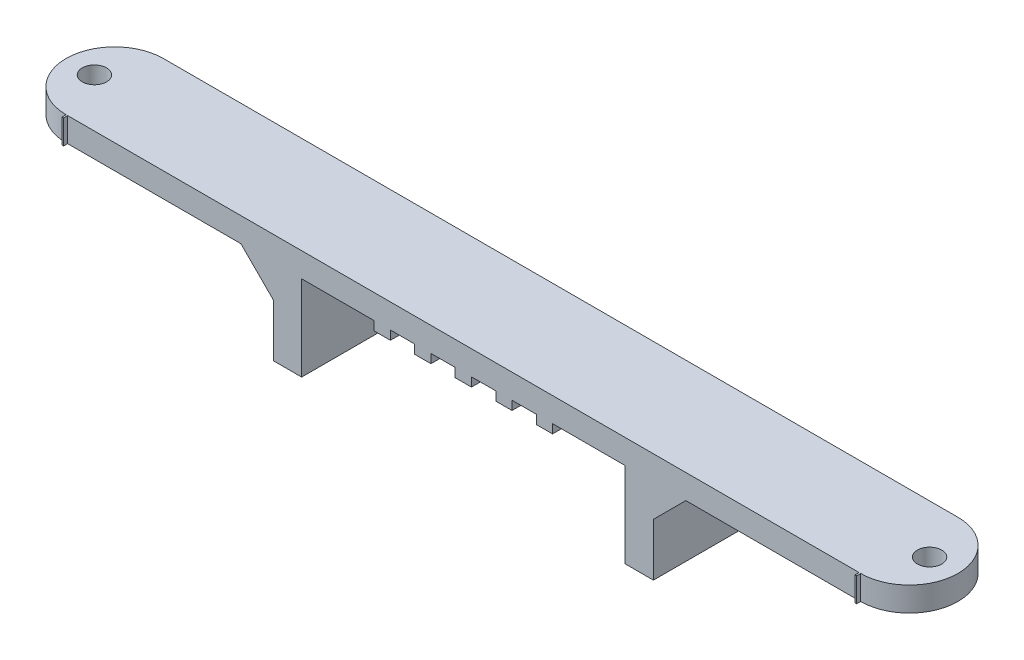
from build123d import *

# Parameters (mm, degrees)
SKETCH1_R           = 1.5
BOSS_EXTRUDE1_DEPTH = 3
SKETCH4_W           = 3.5
SKETCH4_H           = 12
BOSS_EXTRUDE3_DEPTH = 10.5
SKETCH5_W           = 2
SKETCH5_H           = 12
BOSS_EXTRUDE4_DEPTH = 1.1
SKETCH6_W           = 0.2
SKETCH6_H           = 3
BOSS_EXTRUDE5_DEPTH = 0.5
CHAMFER1_SIZE       = 4


with BuildPart() as part:
    # Sketch1 → Boss-Extrude1 (new body)
    with BuildSketch(Plane(origin=(0, 0, 0), x_dir=(1, 0, 0), z_dir=(0, 1, 0))):
        with BuildLine():
            Line((-49, 6), (49, 6))
            ThreePointArc((49, 6), (55, 0), (49, -6))
            Line((49, -6), (-49, -6))
            ThreePointArc((-49, -6), (-55, 0), (-49, 6))
        make_face()
        with Locations(Location((-51.5, 0, 0), (0, 0, 270))):
            Circle(SKETCH1_R, mode=Mode.SUBTRACT)
        with Locations(Location((51.5, 0, 0), (0, 0, 270))):
            Circle(SKETCH1_R, mode=Mode.SUBTRACT)
    extrude(amount=BOSS_EXTRUDE1_DEPTH)

    # Sketch4 → Boss-Extrude3 (add)
    with BuildSketch(Plane.XZ):
        with Locations((-21.690023983, 0)):
            Rectangle(SKETCH4_W, SKETCH4_H)
        with Locations((21.690023983, 0)):
            Rectangle(SKETCH4_W, SKETCH4_H)
    extrude(amount=BOSS_EXTRUDE3_DEPTH)

    # Sketch5 → Boss-Extrude4 (add)
    with BuildSketch(Plane.XZ):
        with Locations((5, 0)):
            Rectangle(SKETCH5_W, SKETCH5_H)
        Rectangle(SKETCH5_W, SKETCH5_H)
        with Locations((10, 0)):
            Rectangle(SKETCH5_W, SKETCH5_H)
        with Locations((-5, 0)):
            Rectangle(SKETCH5_W, SKETCH5_H)
        with Locations((-10, 0)):
            Rectangle(SKETCH5_W, SKETCH5_H)
    extrude(amount=BOSS_EXTRUDE4_DEPTH)

    # Sketch6 → Boss-Extrude5 (add)
    with BuildSketch(Plane.XY.offset(6)):
        with Locations((48.9, 1.5)):
            Rectangle(SKETCH6_W, SKETCH6_H)
        with Locations((-48.9, 1.5)):
            Rectangle(SKETCH6_W, SKETCH6_H)
    extrude(amount=BOSS_EXTRUDE5_DEPTH)

    # Chamfer1
    chamfer1_edges = [part.edges().sort_by_distance(p)[0] for p in [
        (-23.440023983, 0, 0),
        (23.440023983, 0, 0),
    ]]
    chamfer(chamfer1_edges, length=CHAMFER1_SIZE)


solid = part.part
